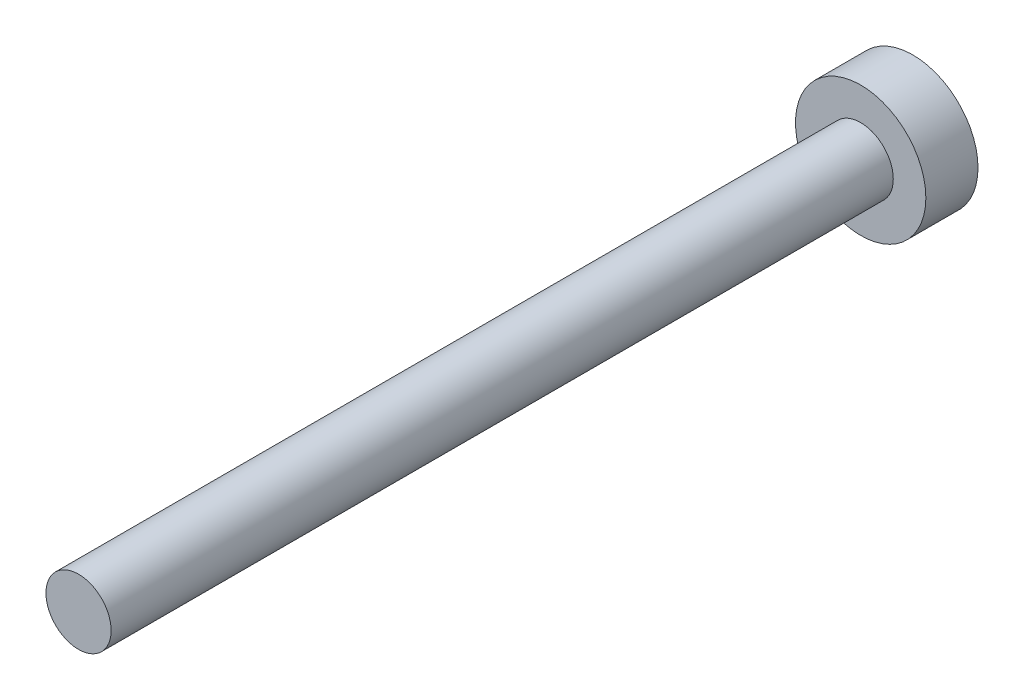
from build123d import *

# Parameters (mm, degrees)
SKETCH1_R           = 7.9375
BOSS_EXTRUDE1_DEPTH = 6.35
SKETCH2_R           = 3.96875
BOSS_EXTRUDE2_DEPTH = 95.25


with BuildPart() as part:
    # Sketch1 → Boss-Extrude1 (new body)
    with BuildSketch(Plane.XY):
        Circle(SKETCH1_R)
    extrude(amount=BOSS_EXTRUDE1_DEPTH)

    # Sketch2 → Boss-Extrude2 (add)
    with BuildSketch(Plane.XY.offset(6.35)):
        Circle(SKETCH2_R)
    extrude(amount=BOSS_EXTRUDE2_DEPTH)


solid = part.part
